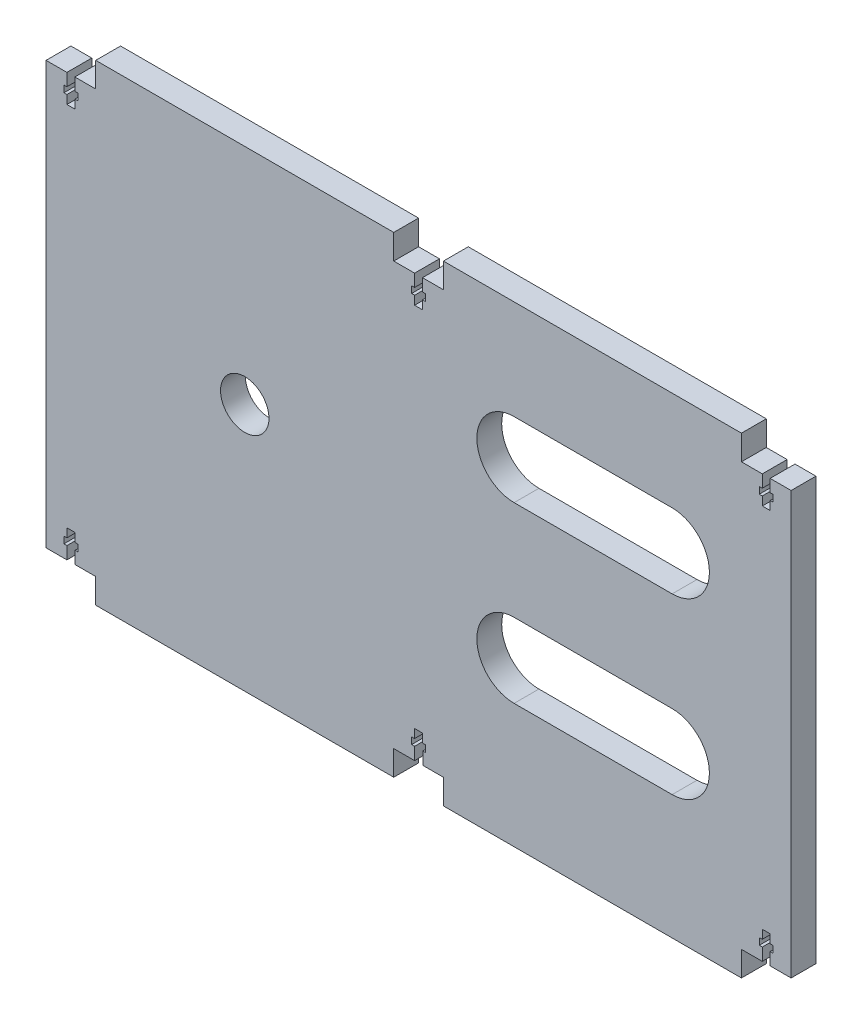
from build123d import *

# Parameters (mm, degrees)
IZIM1_W                     = 300
IZIM1_H                     = 180
IZIM1_R                     = 9.75
Y_KSEKLIK_EKSTR_ZYON1_DEPTH = 10
IZIM2_W                     = 120
IZIM2_H                     = 10
Y_KSEKLIK_EKSTR_ZYON2_DEPTH = 10
IZIM3_W                     = 20
IZIM3_H                     = 10
KES_EKSTR_ZYON1_DEPTH       = 10
IZIM4_W                     = 5.6
IZIM4_H                     = 2.7
KES_EKSTR_ZYON2_DEPTH       = 10
IZIM5_W                     = 3.2
IZIM5_H                     = 3.5
IZIM5_W_2                   = 3.168851203
IZIM5_H_2                   = 5
IZIM5_H_3                   = 5.09138305
IZIM5_W_3                   = 3.157417266
IZIM5_W_4                   = 3.164794192
IZIM5_W_5                   = 3.283155767
IZIM5_W_6                   = 3.292541888
KES_EKSTR_ZYON3_DEPTH       = 10
KES_EKSTR_ZYON4_DEPTH       = 10


with BuildPart() as part:
    # Çizim1 → Yükseklik-Ekstrüzyon1 (new body)
    with BuildSketch(Plane.XY):
        Rectangle(IZIM1_W, IZIM1_H)
        with Locations((-70, 10)):
            Circle(IZIM1_R, mode=Mode.SUBTRACT)
    extrude(amount=Y_KSEKLIK_EKSTR_ZYON1_DEPTH)

    # Çizim2 → Yükseklik-Ekstrüzyon2 (add)
    with BuildSketch(Plane(origin=(0, 90, 0), x_dir=(1, 0, 0), z_dir=(0, 1, 0))):
        with Locations((70, -5)):
            Rectangle(IZIM2_W, IZIM2_H)
        with Locations((-70, -5)):
            Rectangle(IZIM2_W, IZIM2_H)
    extrude(amount=Y_KSEKLIK_EKSTR_ZYON2_DEPTH)

    # Çizim3 → Kes-Ekstrüzyon1 (cut)
    with BuildSketch(Plane(origin=(0, -90, 0), x_dir=(-1, 0, 0), z_dir=(0, -1, 0))):
        with Locations((140, -5)):
            Rectangle(IZIM3_W, IZIM3_H)
        with Locations((-140, -5)):
            Rectangle(IZIM3_W, IZIM3_H)
        with Locations((0, -5)):
            Rectangle(IZIM3_W, IZIM3_H)
    extrude(amount=-KES_EKSTR_ZYON1_DEPTH, mode=Mode.SUBTRACT)

    # Çizim4 → Kes-Ekstrüzyon2 (cut)
    with BuildSketch(Plane.XY.offset(10)):
        with Locations((-140, 83.65)):
            Rectangle(IZIM4_W, IZIM4_H)
        with Locations((0, 83.65)):
            Rectangle(IZIM4_W, IZIM4_H)
        with Locations((140, 83.65)):
            Rectangle(IZIM4_W, IZIM4_H)
        with Locations((-140, -73.65)):
            Rectangle(IZIM4_W, IZIM4_H)
        with Locations((0, -73.65)):
            Rectangle(IZIM4_W, IZIM4_H)
        with Locations((140, -73.65)):
            Rectangle(IZIM4_W, IZIM4_H)
    extrude(amount=-KES_EKSTR_ZYON2_DEPTH, mode=Mode.SUBTRACT)

    # Çizim5 → Kes-Ekstrüzyon3 (cut)
    with BuildSketch(Plane.XY.offset(10)):
        with Locations((-140, 80.55)):
            Rectangle(IZIM5_W, IZIM5_H)
        with Locations((0, 80.55)):
            Rectangle(IZIM5_W, IZIM5_H)
        with Locations((140, 80.55)):
            Rectangle(IZIM5_W, IZIM5_H)
        with Locations((-140, -70.55)):
            Rectangle(IZIM5_W, IZIM5_H)
        with Locations((0, -70.55)):
            Rectangle(IZIM5_W, IZIM5_H)
        with Locations((-0.015574398, 87.5)):
            Rectangle(IZIM5_W_2, IZIM5_H_2)
        with Locations((140, -70.55)):
            Rectangle(IZIM5_W, IZIM5_H)
        with Locations((-140, 87.545691525)):
            Rectangle(IZIM5_W, IZIM5_H_3)
        with Locations((139.978708633, 87.5)):
            Rectangle(IZIM5_W_3, IZIM5_H_2)
        with Locations((139.982397096, -77.5)):
            Rectangle(IZIM5_W_4, IZIM5_H_2)
        with Locations((0.041577884, -77.5)):
            Rectangle(IZIM5_W_5, IZIM5_H_2)
        with Locations((-139.953729056, -77.5)):
            Rectangle(IZIM5_W_6, IZIM5_H_2)
    extrude(amount=-KES_EKSTR_ZYON3_DEPTH, mode=Mode.SUBTRACT)

    # Çizim6 → Kes-Ekstrüzyon4 (cut)
    with BuildSketch(Plane.XY.offset(10)):
        with BuildLine():
            Line((38.464975521, 60), (102.095024479, 60))
            ThreePointArc((102.095024479, 60), (117.095024479, 45), (102.095024479, 30))
            Line((102.095024479, 30), (38.464975521, 30))
            ThreePointArc((38.464975521, 30), (23.464975521, 45), (38.464975521, 60))
        make_face()
        with BuildLine():
            Line((38.464975521, -40), (102.095024479, -40))
            ThreePointArc((102.095024479, -40), (117.095024479, -25), (102.095024479, -10))
            Line((102.095024479, -10), (38.464975521, -10))
            ThreePointArc((38.464975521, -10), (23.464975521, -25), (38.464975521, -40))
        make_face()
    extrude(amount=-KES_EKSTR_ZYON4_DEPTH, mode=Mode.SUBTRACT)


solid = part.part
